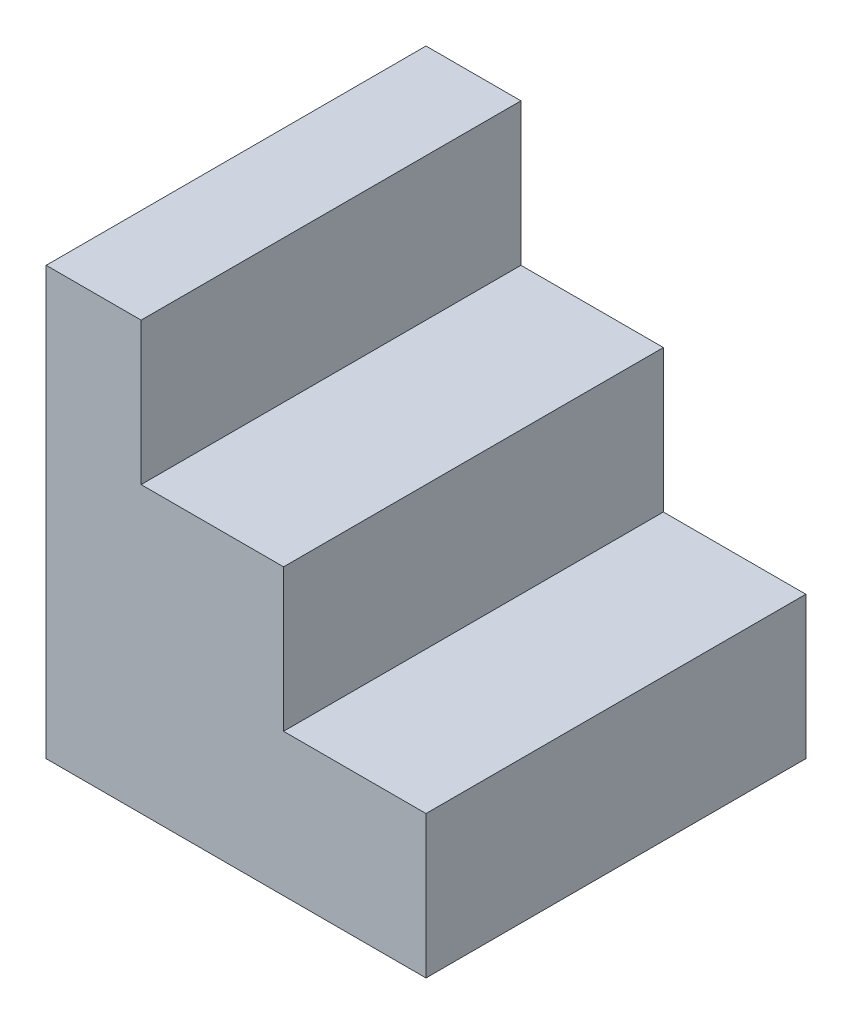
from build123d import *

# Parameters (mm, degrees)
SKETCH_1_W      = 40
SKETCH_1_H      = 40
EXTRUDE_1_DEPTH = 15
SKETCH_2_W      = 25
SKETCH_2_H      = 40
EXTRUDE_2_DEPTH = 15
SKETCH_3_W      = 10
SKETCH_3_H      = 40
EXTRUDE_3_DEPTH = 15


with BuildPart() as part:
    # 草圖1 → 填料-伸長1 (new body)
    with BuildSketch(Plane(origin=(0, 0, 0), x_dir=(1, 0, 0), z_dir=(0, 1, 0))):
        Rectangle(SKETCH_1_W, SKETCH_1_H)
    extrude(amount=EXTRUDE_1_DEPTH)

    # 草圖2 → 填料-伸長2 (add)
    with BuildSketch(Plane(origin=(0, 15, 0), x_dir=(1, 0, 0), z_dir=(0, 1, 0))):
        with Locations((-7.5, 0)):
            Rectangle(SKETCH_2_W, SKETCH_2_H)
    extrude(amount=EXTRUDE_2_DEPTH)

    # 草圖3 → 填料-伸長3 (add)
    with BuildSketch(Plane(origin=(0, 30, 0), x_dir=(1, 0, 0), z_dir=(0, 1, 0))):
        with Locations((-15, 0)):
            Rectangle(SKETCH_3_W, SKETCH_3_H)
    extrude(amount=EXTRUDE_3_DEPTH)


solid = part.part
